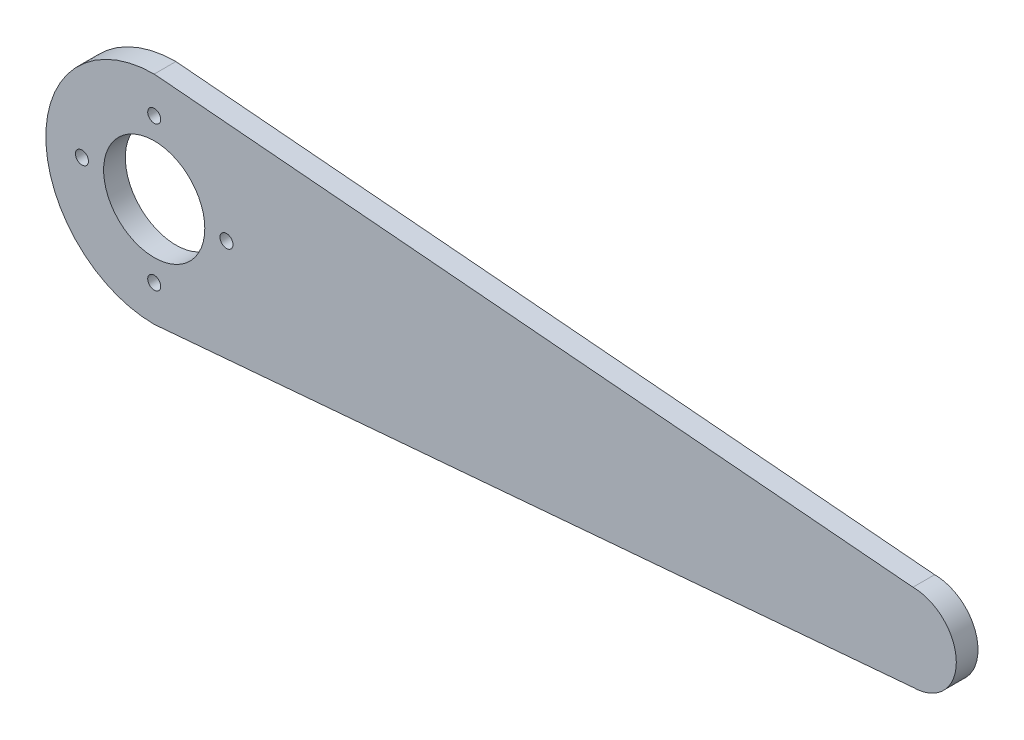
from build123d import *

# Parameters (mm, degrees)
SKETCH1_R           = 6
SKETCH1_R_2         = 0.9
SKETCH1_R_3         = 7
BOSS_EXTRUDE1_DEPTH = 3


with BuildPart() as part:
    # Sketch1 → Boss-Extrude1 (new body)
    # profile 1 of 3: a face of its own
    with BuildSketch(Plane.XY):
        with BuildLine():
            Line((105, 6), (2.55267423, 14.781199352))
            ThreePointArc((2.55267423, 14.781199352), (11.473667972, 9.662036187), (15, 0))
            ThreePointArc((15, 0), (11.473667972, -9.662036187), (2.55267423, -14.781199352))
            Line((2.55267423, -14.781199352), (105, -6))
            ThreePointArc((105, -6), (99, 0), (105, 6))
        make_face()
    # profile 2 of 3: a face of its own
    with BuildSketch(Plane.XY):
        with Locations((105, 0)):
            Circle(SKETCH1_R)
    # profile 3 of 3: a face of its own
    with BuildSketch(Plane.XY):
        with BuildLine():
            Line((2.55267423, 14.781199352), (0, 15))
            ThreePointArc((0, 15), (-15, 0), (0, -15))
            Line((0, -15), (2.55267423, -14.781199352))
            ThreePointArc((2.55267423, -14.781199352), (11.473667972, -9.662036187), (15, 0))
            ThreePointArc((15, 0), (11.473667972, 9.662036187), (2.55267423, 14.781199352))
        make_face()
        with Locations((0, -10)):
            Circle(SKETCH1_R_2, mode=Mode.SUBTRACT)
        with Locations((10, 0)):
            Circle(SKETCH1_R_2, mode=Mode.SUBTRACT)
        with Locations((-10, 0)):
            Circle(SKETCH1_R_2, mode=Mode.SUBTRACT)
        Circle(SKETCH1_R_3, mode=Mode.SUBTRACT)
        with Locations((0, 10)):
            Circle(SKETCH1_R_2, mode=Mode.SUBTRACT)
    extrude(amount=BOSS_EXTRUDE1_DEPTH)


solid = part.part
